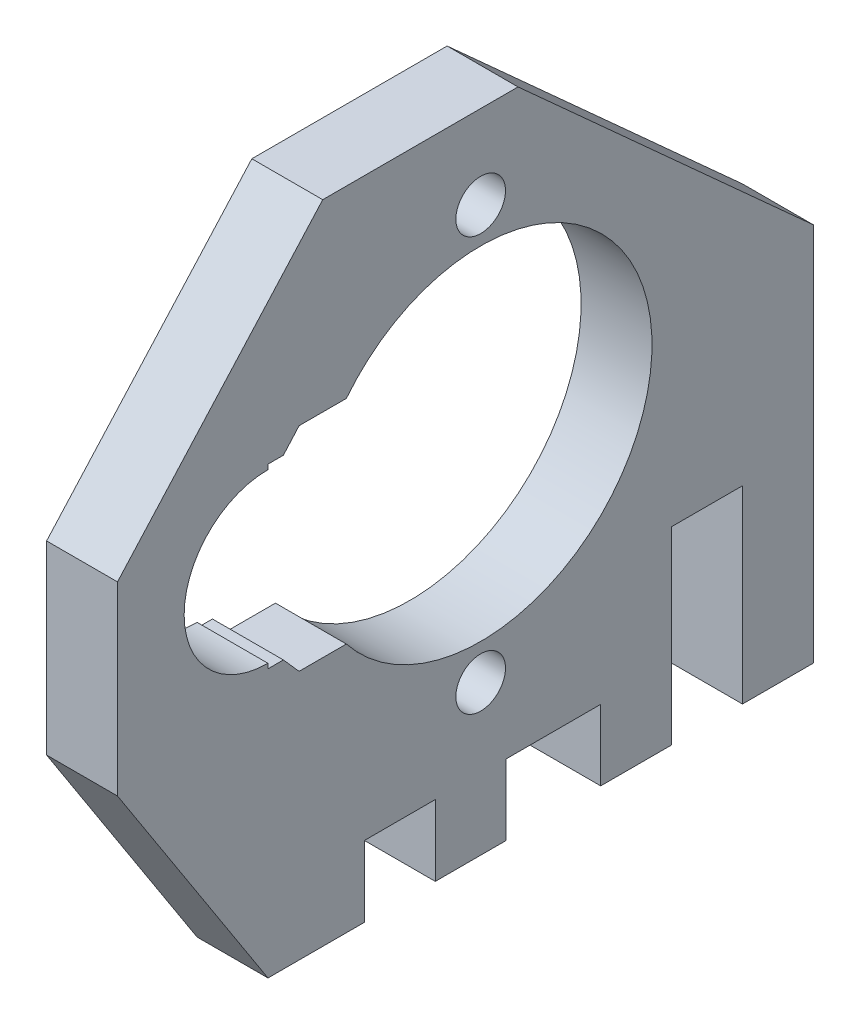
from build123d import *

# Parameters (mm, degrees)
SKETCH1_R           = 2.1
BOSS_EXTRUDE1_DEPTH = 6


with BuildPart() as part:
    # Sketch1 → Boss-Extrude1 (new body)
    with BuildSketch(Plane(origin=(0, 0, 0), x_dir=(0, 0, -1), z_dir=(1, 0, 0))):
        Polygon((1.8561273, -23.10816726), (10.014395287, -23.10816726), (10.014395287, -17.10816726), (16.014395287, -17.10816726), (16.014395287, -23.10816726), (22.014395287, -23.10816726), (22.014395287, -17.128409951), (30.014395287, -17.128409951), (30.014395287, -23.10816726), (36.014395287, -23.10816726), (36.014395287, -7.10816726), (42.014395287, -7.10816726), (42.014395287, -23.10816726), (48.014395287, -23.10816726), (48.014395287, 9.017628036), (23.016962848, 31.621864486), (6.488451552, 31.621864486), (-10.880328259, 12.294369708), (-10.880328259, -3.400467914), align=None)
        with Locations((19.8561273, -10.445316887)):
            Circle(SKETCH1_R, mode=Mode.SUBTRACT)
        with BuildLine():
            Line((8.487310299, -1.945316887), (4.487310299, -1.945316887))
            Line((4.487310299, -1.945316887), (3.1561273, -0.445316887))
            Line((3.1561273, -0.445316887), (1.8561273, -0.445316887))
            Line((1.8561273, -0.445316887), (1.8561273, -0.041769088))
            ThreePointArc((1.8561273, -0.041769088), (-5.240324902, 7.054683113), (1.8561273, 14.151135315))
            Line((1.8561273, 14.151135315), (1.8561273, 14.554683113))
            Line((1.8561273, 14.554683113), (3.1561273, 14.554683113))
            Line((3.1561273, 14.554683113), (4.487310299, 16.054683113))
            Line((4.487310299, 16.054683113), (8.487310299, 16.054683113))
            ThreePointArc((8.487310299, 16.054683113), (34.3561273, 7.054683113), (8.487310299, -1.945316887))
        make_face(mode=Mode.SUBTRACT)
        with Locations((19.8561273, 24.554683113)):
            Circle(SKETCH1_R, mode=Mode.SUBTRACT)
    extrude(amount=BOSS_EXTRUDE1_DEPTH)


solid = part.part
